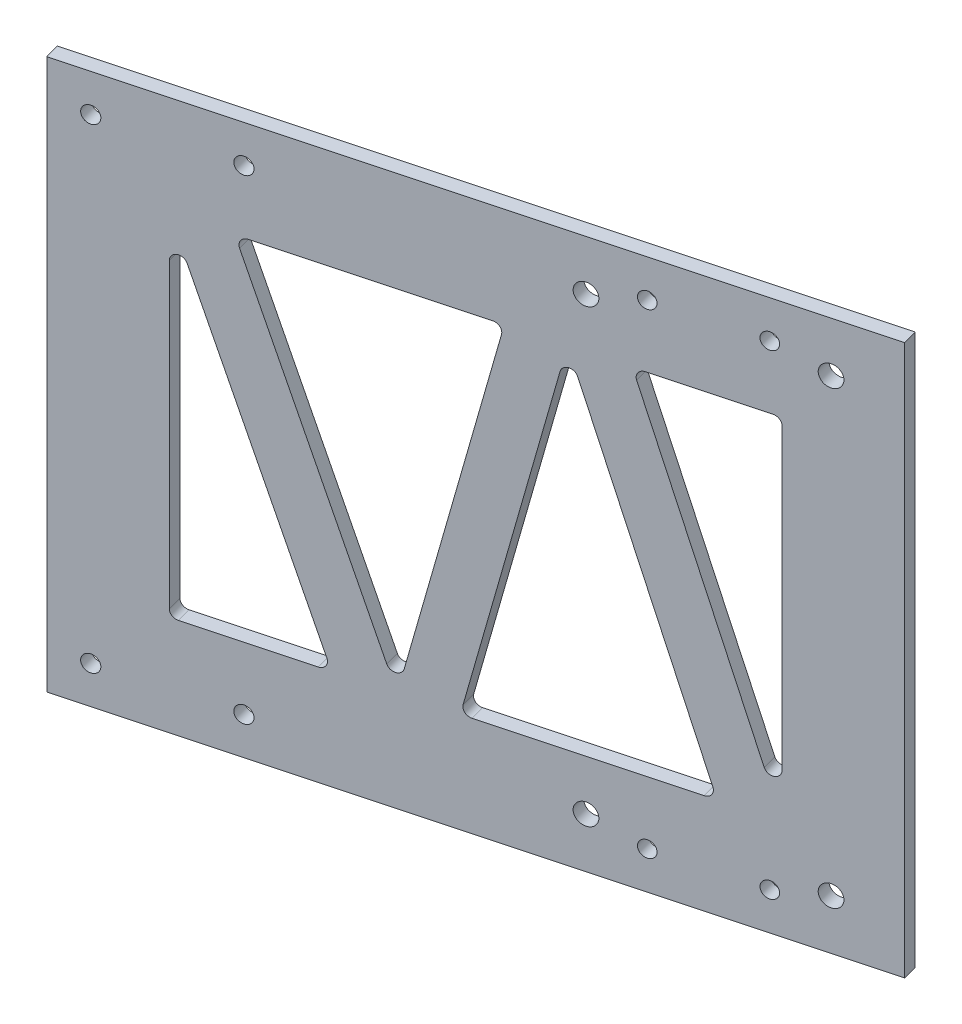
from build123d import *

# Parameters (mm, degrees)
SKETCH2_W      = 140
SKETCH2_H      = 110
SKETCH2_R      = 1.6
SKETCH2_R_2    = 2.1
EXTRUDE1_DEPTH = 3


with BuildPart() as part:
    # Sketch2 → Extrude1 (new body)
    with BuildSketch(Plane(origin=(-8.535929163, 0, -31.856521324), x_dir=(0.9659258262890755, 0, -0.2588190451024938), z_dir=(0.2588190451024938, 0, 0.9659258262890756))):
        with Locations((118.519484346, 45.004395502)):
            Rectangle(SKETCH2_W, SKETCH2_H)
        with Locations((166.519484346, 92.504395502)):
            Circle(SKETCH2_R, mode=Mode.SUBTRACT)
        with Locations((146.519484346, 92.504395502)):
            Circle(SKETCH2_R, mode=Mode.SUBTRACT)
        with Locations((146.519484346, -2.495604498)):
            Circle(SKETCH2_R, mode=Mode.SUBTRACT)
        with Locations((166.519484346, -2.495604498)):
            Circle(SKETCH2_R, mode=Mode.SUBTRACT)
        with Locations((176.519484346, 0.004395502)):
            Circle(SKETCH2_R_2, mode=Mode.SUBTRACT)
        with Locations((136.519484346, 0.004395502)):
            Circle(SKETCH2_R_2, mode=Mode.SUBTRACT)
        with Locations((176.519484346, 90.004395502)):
            Circle(SKETCH2_R_2, mode=Mode.SUBTRACT)
        with Locations((136.519484346, 90.004395502)):
            Circle(SKETCH2_R_2, mode=Mode.SUBTRACT)
        with BuildLine():
            Line((71.422427124, 72.331747658), (94.235598815, 12.035198256))
            ThreePointArc((94.235598815, 12.035198256), (94.06679625, 10.651812407), (92.832656037, 10.004395502))
            Line((92.832656037, 10.004395502), (70.019484346, 10.004395502))
            ThreePointArc((70.019484346, 10.004395502), (68.958824174, 10.44373533), (68.519484346, 11.504395502))
            Line((68.519484346, 11.504395502), (68.519484346, 71.800944904))
            ThreePointArc((68.519484346, 71.800944904), (69.749682721, 73.276481106), (71.422427124, 72.331747658))
        make_face(mode=Mode.SUBTRACT)
        with BuildLine():
            Line((81.382592108, 80.004395502), (121.278221323, 80.004395502))
            ThreePointArc((121.278221323, 80.004395502), (122.460552573, 79.427484239), (122.73341687, 78.140519257))
            Line((122.73341687, 78.140519257), (106.858201548, 14.653157981))
            ThreePointArc((106.858201548, 14.653157981), (105.490462864, 13.519585964), (104.000063225, 14.486231472))
            Line((104.000063225, 14.486231472), (79.979649331, 77.973592748))
            ThreePointArc((79.979649331, 77.973592748), (80.148451895, 79.356978598), (81.382592108, 80.004395502))
        make_face(mode=Mode.SUBTRACT)
        with BuildLine():
            Line((168.519484346, 78.504395502), (168.519484346, 18.857688255))
            ThreePointArc((168.519484346, 18.857688255), (167.270056066, 17.378765061), (165.603199262, 18.363586484))
            Line((165.603199262, 18.363586484), (144.794151706, 78.010293731))
            ThreePointArc((144.794151706, 78.010293731), (144.987499209, 79.372971159), (146.210436791, 80.004395502))
            Line((146.210436791, 80.004395502), (167.019484346, 80.004395502))
            ThreePointArc((167.019484346, 80.004395502), (168.080144518, 79.565055674), (168.519484346, 78.504395502))
        make_face(mode=Mode.SUBTRACT)
        with BuildLine():
            Line((132.289557089, 75.134147375), (116.469724954, 11.868271747))
            ThreePointArc((116.469724954, 11.868271747), (116.742589251, 10.581306765), (117.924920501, 10.004395502))
            Line((117.924920501, 10.004395502), (155.81642558, 10.004395502))
            ThreePointArc((155.81642558, 10.004395502), (157.039363161, 10.635819845), (157.232710664, 11.998497273))
            Line((157.232710664, 11.998497273), (135.16103772, 75.2643729))
            ThreePointArc((135.16103772, 75.2643729), (133.676795459, 76.268730946), (132.289557089, 75.134147375))
        make_face(mode=Mode.SUBTRACT)
        with BuildLine():
            ThreePointArc((54.043190493, -2.495604498), (55.693190493, -4.145604498), (57.343190493, -2.495604498))
            ThreePointArc((57.343190493, -2.495604498), (55.693190493, -0.845604498), (54.043190493, -2.495604498))
        make_face(mode=Mode.SUBTRACT)
        with BuildLine():
            ThreePointArc((79.043190493, -2.495604498), (80.693190493, -4.145604498), (82.343190493, -2.495604498))
            ThreePointArc((82.343190493, -2.495604498), (80.693190493, -0.845604498), (79.043190493, -2.495604498))
        make_face(mode=Mode.SUBTRACT)
        with BuildLine():
            ThreePointArc((79.043190493, 92.504395502), (80.693190493, 90.854395502), (82.343190493, 92.504395502))
            ThreePointArc((82.343190493, 92.504395502), (80.693190493, 94.154395502), (79.043190493, 92.504395502))
        make_face(mode=Mode.SUBTRACT)
        with BuildLine():
            ThreePointArc((54.043190493, 92.504395502), (55.693190493, 90.854395502), (57.343190493, 92.504395502))
            ThreePointArc((57.343190493, 92.504395502), (55.693190493, 94.154395502), (54.043190493, 92.504395502))
        make_face(mode=Mode.SUBTRACT)
    extrude(amount=EXTRUDE1_DEPTH)


solid = part.part
